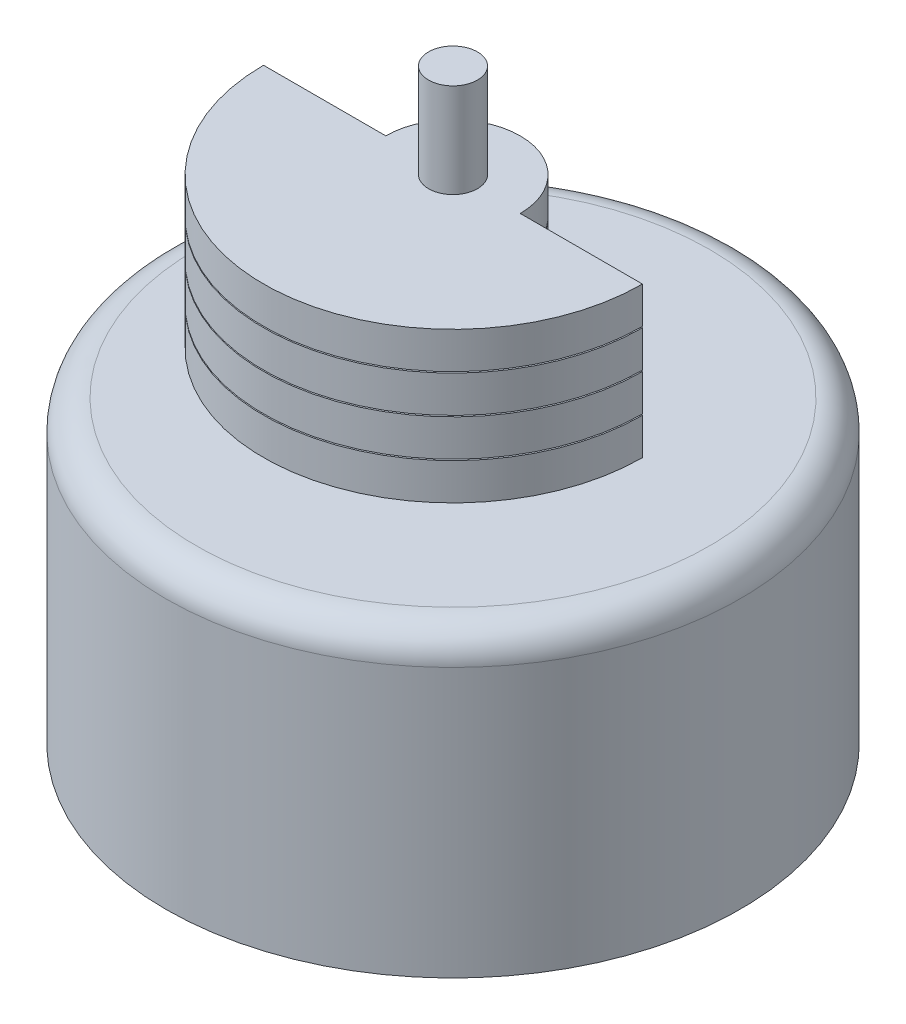
from build123d import *

# Parameters (mm, degrees)
SKETCH1_W           = 1.016
SKETCH1_H           = 10.922
SKETCH1_W_2         = 3.048
SKETCH1_H_2         = 1.524
FILLET1_R           = 1.27
BOSS_EXTRUDE1_DEPTH = 0.762
LPATTERN1_COUNT     = 4
LPATTERN1_PITCH     = 1.5748


with BuildPart() as part:
    # Sketch1 → Revolve1 (revolve)
    with BuildSketch(Plane.XY, mode=Mode.PRIVATE) as revolve1_sk:
        Polygon((-3.302, 13.462), (0, 13.462), (0, 0), (-11.938, 0), (-11.938, 12.446), (-3.302, 12.446), align=None)
        with Locations((-0.508, 18.923)):
            Rectangle(SKETCH1_W, SKETCH1_H)
        with Locations((-1.524, -0.762)):
            Rectangle(SKETCH1_W_2, SKETCH1_H_2)
    revolve(revolve1_sk.sketch.rotate(Axis((0, 0, 0), (0, -1, 0)), 270), axis=Axis((0, 0, 0), (0, -1, 0)))

    # Fillet1
    fillet1_edges = [part.edges().sort_by_distance(p)[0] for p in [
        (0, -1.524, -3.048),
        (0, 12.446, -11.938),
    ]]
    fillet(fillet1_edges, radius=FILLET1_R)

    # Sketch2 → Boss-Extrude1 (add, symmetric)
    with BuildSketch(Plane(origin=(0, 14.986, 0), x_dir=(1, 0, 0), z_dir=(0, 1, 0))):
        with BuildLine():
            Line((-7.874, 0), (-2.794, 0))
            ThreePointArc((-2.794, 0), (0, 2.794), (2.794, 0))
            Line((2.794, 0), (7.874, 0))
            ThreePointArc((7.874, 0), (0, -7.874), (-7.874, 0))
        make_face()
    boss_extrude1 = extrude(amount=BOSS_EXTRUDE1_DEPTH, both=True)

    # LPattern1: Boss-Extrude1 ×4
    with Locations(*[(0, i * LPATTERN1_PITCH, 0) for i in range(1, LPATTERN1_COUNT)]):
        add(boss_extrude1)


solid = part.part
